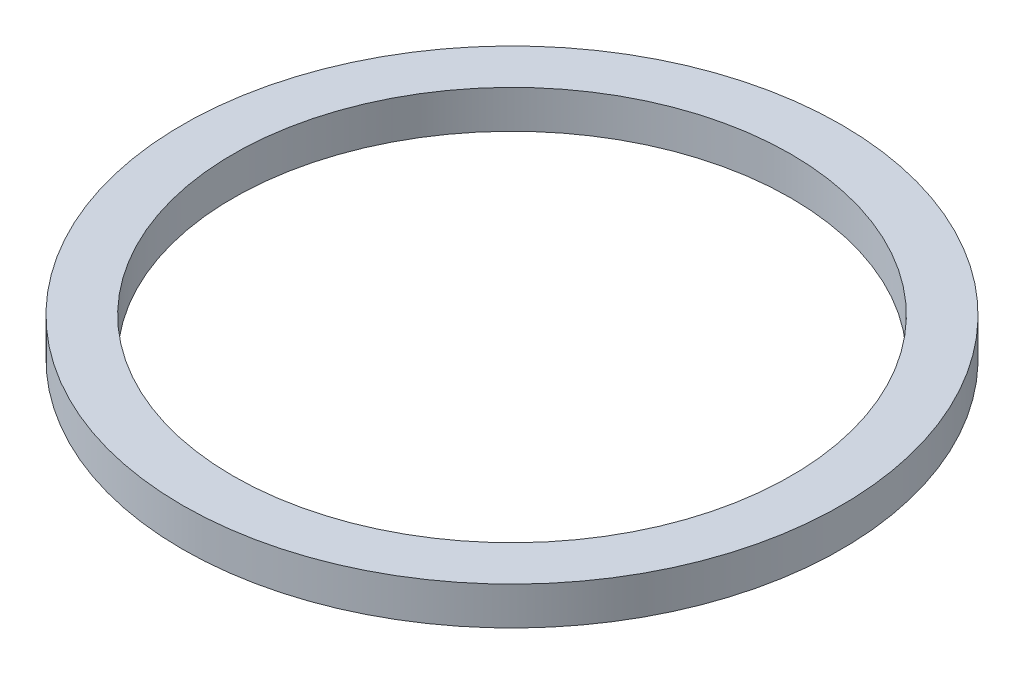
from build123d import *

# Parameters (mm, degrees)
SKETCH1_R           = 13
SKETCH1_R_2         = 11
BOSS_EXTRUDE1_DEPTH = 1.5


with BuildPart() as part:
    # Sketch1 → Boss-Extrude1 (new body)
    with BuildSketch(Plane(origin=(0, 0, 0), x_dir=(1, 0, 0), z_dir=(0, 1, 0))):
        with Locations(Location((0, 0, 0), (0, 0, 270))):
            Circle(SKETCH1_R)
        with Locations(Location((0, 0, 0), (0, 0, 270))):
            Circle(SKETCH1_R_2, mode=Mode.SUBTRACT)
    extrude(amount=BOSS_EXTRUDE1_DEPTH)


solid = part.part
